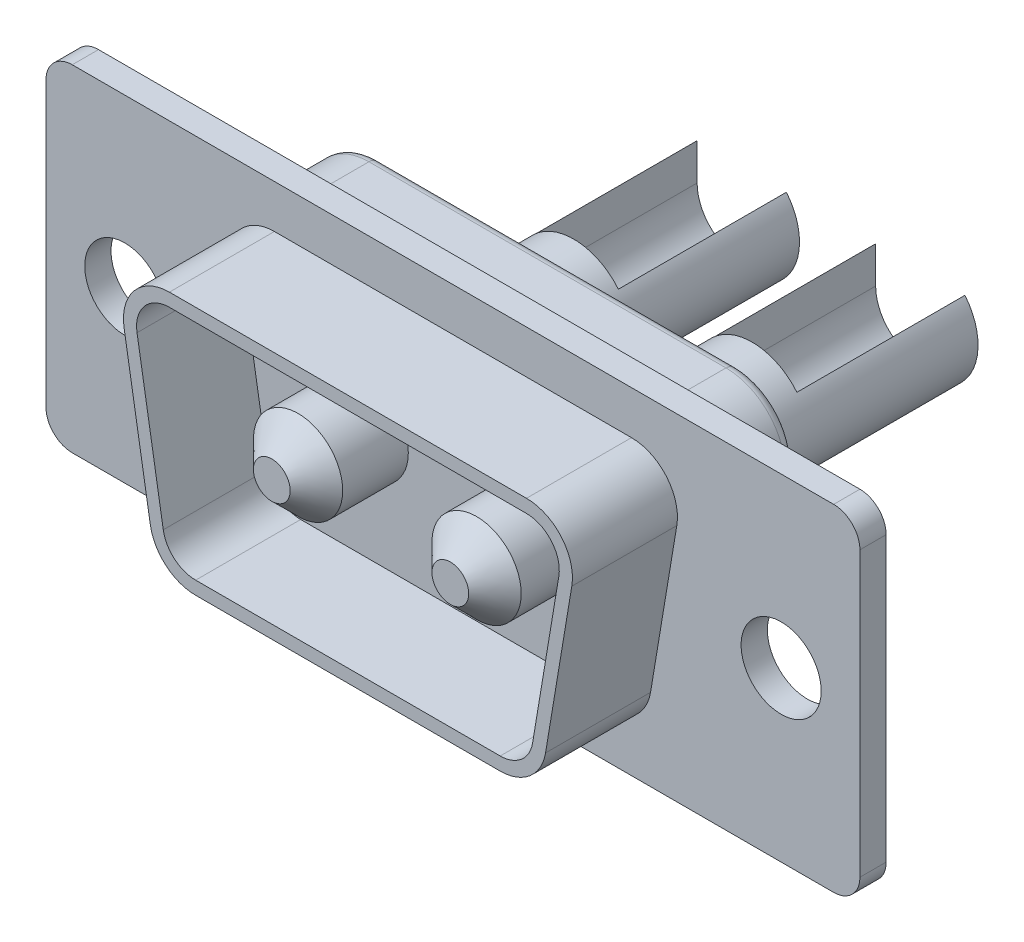
from build123d import *

# Parameters (mm, degrees)
SKETCH1_W           = 31
SKETCH1_H           = 12.8
BOSS_EXTRUDE1_DEPTH = 0.5
SKETCH2_R           = 1.525
CUT_EXTRUDE1_DEPTH  = 17.799107119
BOSS_EXTRUDE5_DEPTH = 4
BOSS_EXTRUDE3_DEPTH = 3
SKETCH6_R           = 2.2
BOSS_EXTRUDE4_DEPTH = 10.4
CUT_EXTRUDE2_START  = -6.4
CUT_EXTRUDE2_DEPTH  = 6.4
BOSS_EXTRUDE6_START = 3.5
SKETCH12_R          = 1.7
BOSS_EXTRUDE6_DEPTH = 3.5
CHAMFER1_SIZE       = 1
FILLET1_R           = 1
FILLET2_R           = 0.4


with BuildPart() as part:
    # Sketch1 → Boss-Extrude1 (new, symmetric)
    with BuildSketch(Plane.XY):
        Rectangle(SKETCH1_W, SKETCH1_H)
    extrude(amount=BOSS_EXTRUDE1_DEPTH, both=True)

    # Sketch2 → Cut-Extrude1 (cut, through all)
    with BuildSketch(Plane.XY.offset(0.5)):
        with Locations((12.5, 0)):
            Circle(SKETCH2_R)
        with Locations((-12.5, 0)):
            Circle(SKETCH2_R)
    extrude(amount=-CUT_EXTRUDE1_DEPTH, mode=Mode.SUBTRACT)

    # Sketch10 → Boss-Extrude5 (add)
    with BuildSketch(Plane.XY.offset(0.5)):
        with BuildLine():
            Line((-7.526189367, -3.287698228), (-8.526189367, 2.712301772))
            ThreePointArc((-8.526189367, 2.712301772), (-8.135284969, 4.131156068), (-6.8, 4.75))
            Line((-6.8, 4.75), (6.8, 4.75))
            ThreePointArc((6.8, 4.75), (8.135284969, 4.131156068), (8.526189367, 2.712301772))
            Line((8.526189367, 2.712301772), (7.526189367, -3.287698228))
            ThreePointArc((7.526189367, -3.287698228), (6.931156068, -4.335284969), (5.8, -4.75))
            Line((5.8, -4.75), (-5.8, -4.75))
            ThreePointArc((-5.8, -4.75), (-6.931156068, -4.335284969), (-7.526189367, -3.287698228))
        make_face()
        with BuildLine():
            Line((-7.032992405, -3.205498734), (-8.032992405, 2.794501266))
            ThreePointArc((-8.032992405, 2.794501266), (-7.753774978, 3.80796862), (-6.8, 4.25))
            Line((-6.8, 4.25), (6.8, 4.25))
            ThreePointArc((6.8, 4.25), (7.753774978, 3.80796862), (8.032992405, 2.794501266))
            Line((8.032992405, 2.794501266), (7.032992405, -3.205498734))
            ThreePointArc((7.032992405, -3.205498734), (6.60796862, -3.953774978), (5.8, -4.25))
            Line((5.8, -4.25), (-5.8, -4.25))
            ThreePointArc((-5.8, -4.25), (-6.60796862, -3.953774978), (-7.032992405, -3.205498734))
        make_face(mode=Mode.SUBTRACT)
    extrude(amount=BOSS_EXTRUDE5_DEPTH)

    # Sketch5 → Boss-Extrude3 (add)
    with BuildSketch(Plane(origin=(0, 0, -0.5), x_dir=(-1, 0, 0), z_dir=(0, 0, -1))):
        with BuildLine():
            Line((8.019386329, -3.369897721), (9.019386329, 2.630102279))
            ThreePointArc((9.019386329, 2.630102279), (8.516794961, 4.454343516), (6.8, 5.25))
            Line((6.8, 5.25), (-6.8, 5.25))
            ThreePointArc((-6.8, 5.25), (-8.516794961, 4.454343516), (-9.019386329, 2.630102279))
            Line((-9.019386329, 2.630102279), (-8.019386329, -3.369897721))
            ThreePointArc((-8.019386329, -3.369897721), (-7.254343516, -4.716794961), (-5.8, -5.25))
            Line((-5.8, -5.25), (5.8, -5.25))
            ThreePointArc((5.8, -5.25), (7.254343516, -4.716794961), (8.019386329, -3.369897721))
        make_face()
    extrude(amount=BOSS_EXTRUDE3_DEPTH)

    # Sketch6 → Boss-Extrude4 (add)
    with BuildSketch(Plane(origin=(0, 0, -3.5), x_dir=(-1, 0, 0), z_dir=(0, 0, -1))):
        with Locations((-3.4, 0)):
            Circle(SKETCH6_R)
        with Locations(Location((3.4, 0, 0), (0, 0, 180))):
            Circle(SKETCH6_R)
    extrude(amount=BOSS_EXTRUDE4_DEPTH)

    # Sketch7 → Cut-Extrude2 (cut)
    with BuildSketch(Plane(origin=(0, 0, -13.9), x_dir=(-1, 0, 0), z_dir=(0, 0, -1)).offset(CUT_EXTRUDE2_START)):
        with BuildLine():
            Line((-5.1, 0), (-5.1, 1.396424004))
            ThreePointArc((-5.1, 1.396424004), (-3.4, 2.2), (-1.7, 1.396424004))
            Line((-1.7, 1.396424004), (-1.7, 0))
            ThreePointArc((-1.7, 0), (-3.4, -1.7), (-5.1, 0))
        make_face()
        with BuildLine():
            Line((1.7, 0), (1.7, 1.396424004))
            ThreePointArc((1.7, 1.396424004), (3.4, 2.2), (5.1, 1.396424004))
            Line((5.1, 1.396424004), (5.1, 0))
            ThreePointArc((5.1, 0), (3.4, -1.7), (1.7, 0))
        make_face()
    extrude(amount=CUT_EXTRUDE2_DEPTH, mode=Mode.SUBTRACT)

    # Sketch12 → Boss-Extrude6 (add)
    with BuildSketch(Plane.XY.offset(0.5).offset(BOSS_EXTRUDE6_START)):
        with Locations((-3.4, 0)):
            Circle(SKETCH12_R)
        with Locations((3.4, 0)):
            Circle(SKETCH12_R)
    extrude(amount=-BOSS_EXTRUDE6_DEPTH)

    # Chamfer1
    chamfer1_edges = [part.edges().sort_by_distance(p)[0] for p in [
        (-5.1, 0, 4),
        (1.7, 0, 4),
    ]]
    chamfer(chamfer1_edges, length=CHAMFER1_SIZE)

    # Fillet1
    fillet1_edges = [part.edges().sort_by_distance(p)[0] for p in [
        (-15.5, 6.4, 0),
        (15.5, 6.4, 0),
        (15.5, -6.4, 0),
        (-15.5, -6.4, 0),
    ]]
    fillet(fillet1_edges, radius=FILLET1_R)

    # Fillet2
    fillet2_edges = [part.edges().sort_by_distance(p)[0] for p in [
        (-8.516794961, 4.454343516, -3.5),
        (0, 5.25, -3.5),
        (8.516794961, 4.454343516, -3.5),
        (8.519386329, -0.369897721, -3.5),
        (7.254343516, -4.716794961, -3.5),
        (0, -5.25, -3.5),
        (-7.254343516, -4.716794961, -3.5),
        (-8.519386329, -0.369897721, -3.5),
    ]]
    fillet(fillet2_edges, radius=FILLET2_R)


solid = part.part
